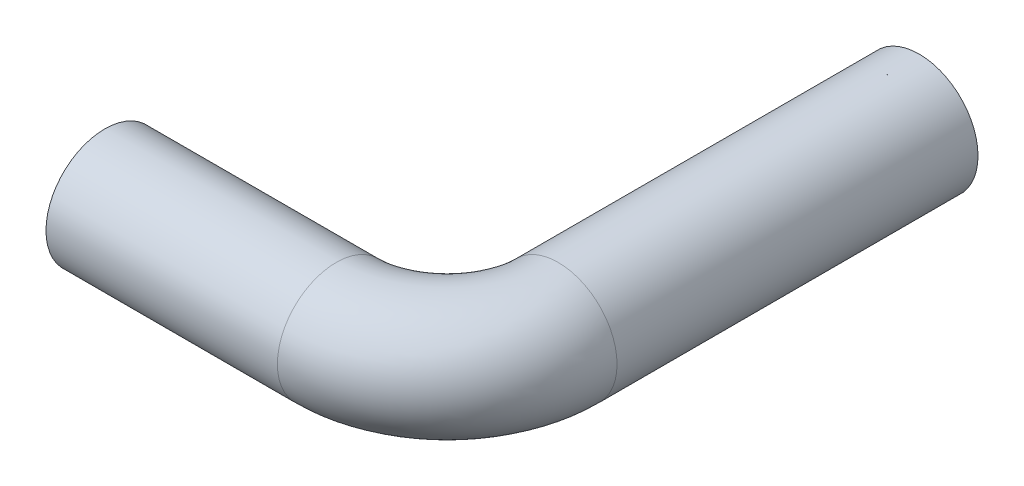
from build123d import *

# Parameters (mm, degrees)
TUBE_PROFILE_R   = 3.175
TUBE_PROFILE_R_2 = 2.175


with BuildPart() as part:
    # Tube: sweep along a curve in space
    with BuildLine() as tube_path:
        Line((182, 326, 199.5), (182, 326, 219))
        ThreePointArc((176, 326, 225), (180.242640687, 326, 223.242640687), (182, 326, 219))
        Line((176, 326, 225), (163.5, 326, 225))
    # Tube profile (on start of the path) → Tube (sweep)
    with BuildSketch(Plane(origin=(182, 326, 199.5), x_dir=(1, 0, 0), z_dir=(0, 0, 1))):
        Circle(TUBE_PROFILE_R)
        Circle(TUBE_PROFILE_R_2, mode=Mode.SUBTRACT)
    sweep(path=tube_path.line)


solid = part.part
